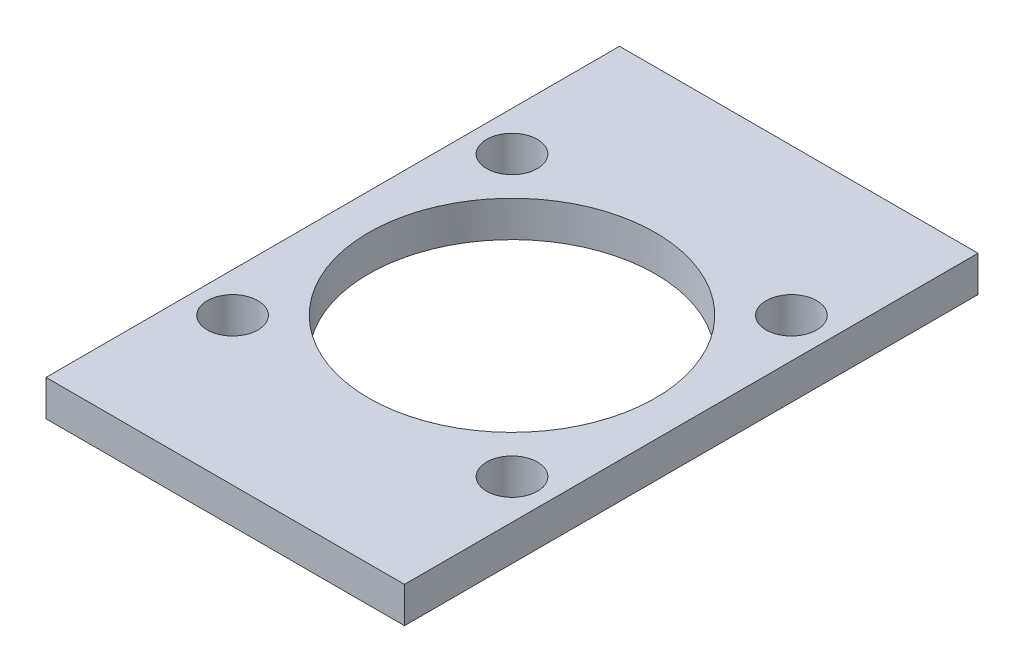
from build123d import *

# Parameters (mm, degrees)
SKETCH1_W            = 31.75
SKETCH1_H            = 50.8
BOSS_EXTRUDE1_DEPTH  = 3.175
CUT_EXTRUDE1_REACH   = 32.121
SKETCH2_R            = 12.7
M4_CLEARANCE_HOLE1_D = 4.4958


with BuildPart() as part:
    # Sketch1 → Boss-Extrude1 (new body)
    with BuildSketch(Plane(origin=(0, 0, 0), x_dir=(1, 0, 0), z_dir=(0, 1, 0))):
        Rectangle(SKETCH1_W, SKETCH1_H)
    extrude(amount=BOSS_EXTRUDE1_DEPTH)

    # Sketch2 → Cut-Extrude1 (cut, up to next)
    with BuildSketch(Plane(origin=(0, 3.175, 0), x_dir=(1, 0, 0), z_dir=(0, 1, 0)), mode=Mode.PRIVATE) as cut_extrude1_sk1:
        with Locations(Location((0, 0, 0), (0, 0, 270))):
            Circle(SKETCH2_R)
    cut_extrude1_tool1 = extrude(cut_extrude1_sk1.sketch, amount=-CUT_EXTRUDE1_REACH, mode=Mode.PRIVATE) & part.part
    add(cut_extrude1_tool1.solids().sort_by_distance((0, 3.175, 0))[0], mode=Mode.SUBTRACT)

    # M4 Clearance Hole1 (through all)
    with Locations(Plane(origin=(0, 3.175, 0), x_dir=(1, 0, 0), z_dir=(0, 1, 0))):
        with Locations((12.374792935, -12.374792935), (-12.374792935, -12.374792935), (-12.374792935, 12.374792935), (12.374792935, 12.374792935)):
            Hole(M4_CLEARANCE_HOLE1_D / 2)


solid = part.part
